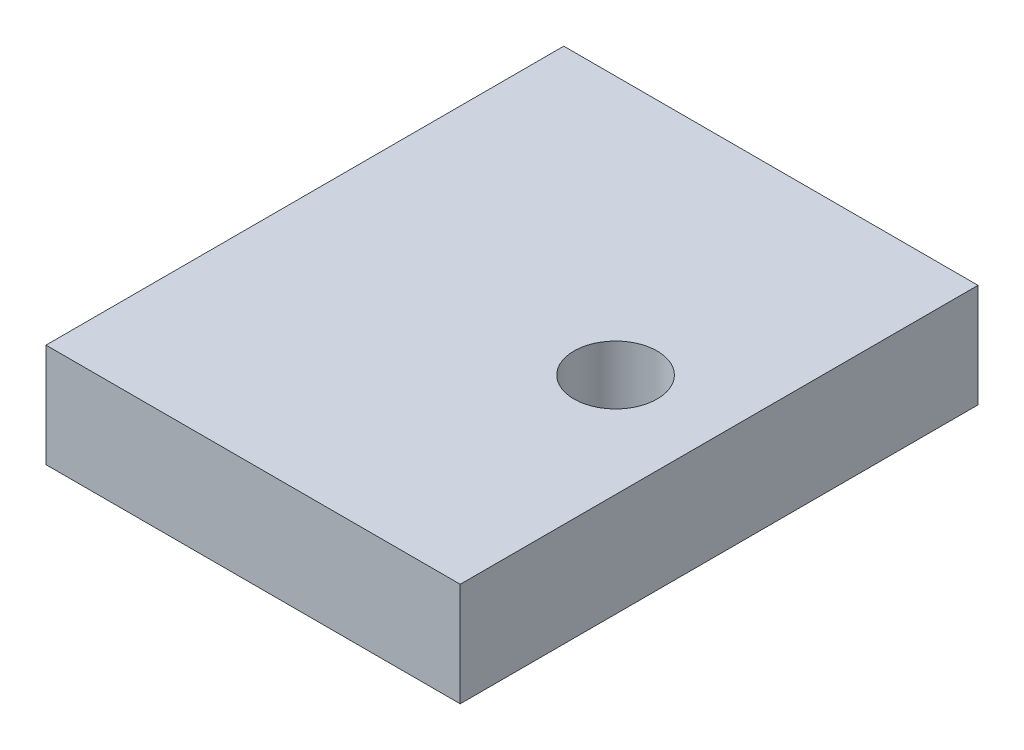
from build123d import *

# Parameters (mm, degrees)
SKETCH2_W                   = 25.4
SKETCH2_H                   = 31.75
BOSS_EXTRUDE1_DEPTH         = 6.35
F_1_4_20_TAPPED_HOLE1_D     = 5.1054
F_1_4_20_TAPPED_HOLE1_DEPTH = 19.05
F_1_4_20_TAPPED_HOLE1_TIP   = 1.533816902


with BuildPart() as part:
    # Sketch2 → Boss-Extrude1 (new body)
    with BuildSketch(Plane(origin=(0, 0, 0), x_dir=(1, 0, 0), z_dir=(0, 1, 0))):
        with Locations((12.7, 15.875)):
            Rectangle(SKETCH2_W, SKETCH2_H)
    extrude(amount=BOSS_EXTRUDE1_DEPTH)

    # 1/4-20 Tapped Hole1
    with Locations(Plane(origin=(19.05, 6.35, -15.875), x_dir=(0, 0, 1), z_dir=(0, 1, 0))):
        with Locations((0, 0)):
            Hole(F_1_4_20_TAPPED_HOLE1_D / 2, depth=F_1_4_20_TAPPED_HOLE1_DEPTH)
            with Locations((0, 0, -(F_1_4_20_TAPPED_HOLE1_DEPTH + F_1_4_20_TAPPED_HOLE1_TIP / 2))):  # 118° drill point
                Cone(0, F_1_4_20_TAPPED_HOLE1_D / 2, F_1_4_20_TAPPED_HOLE1_TIP, mode=Mode.SUBTRACT)


solid = part.part
